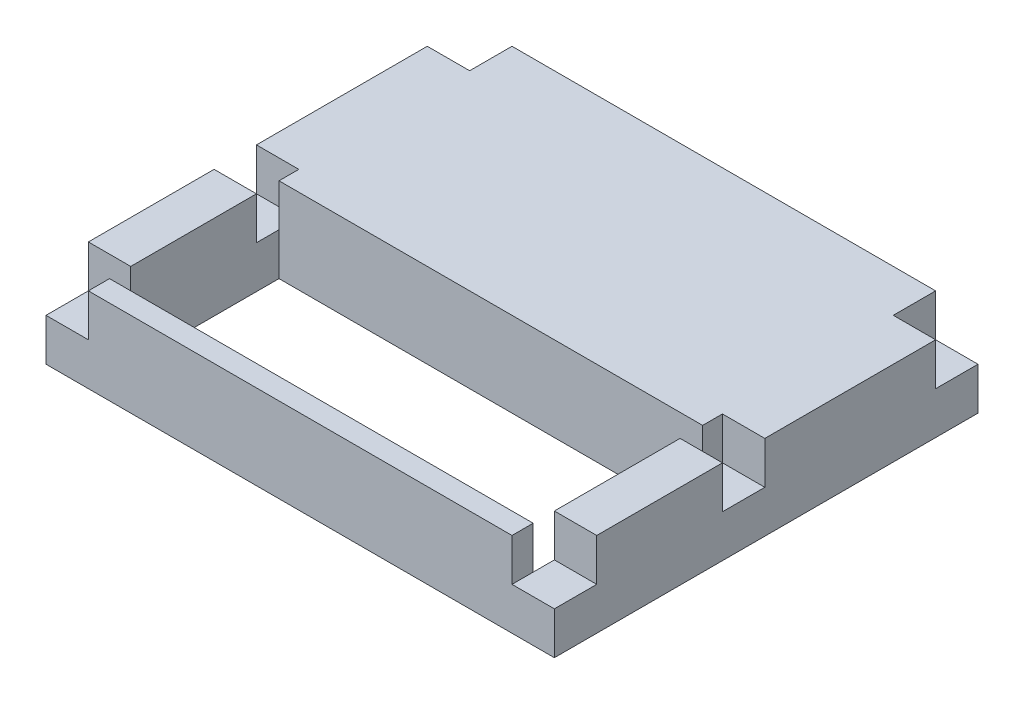
from build123d import *

# Parameters (mm, degrees)
SKETCH1_W           = 120
SKETCH1_H           = 100
BOSS_EXTRUDE1_DEPTH = 20
SKETCH6_W           = 110
SKETCH6_H           = 40
CUT_EXTRUDE1_DEPTH  = 20
SKETCH6_3_W         = 5
SKETCH6_3_H         = 40
BOSS_EXTRUDE4_DEPTH = 20
SKETCH14_W          = 10
SKETCH14_H          = 10
CUT_EXTRUDE2_DEPTH  = 10
SKETCH15_W          = 10
SKETCH15_H          = 10
CUT_EXTRUDE3_DEPTH  = 10


with BuildPart() as part:
    # Sketch1 → Boss-Extrude1 (new body)
    with BuildSketch(Plane(origin=(0, 0, 0), x_dir=(1, 0, 0), z_dir=(0, 1, 0))):
        Rectangle(SKETCH1_W, SKETCH1_H)
    extrude(amount=BOSS_EXTRUDE1_DEPTH)

    # Sketch6 → Cut-Extrude1 (cut)
    with BuildSketch(Plane.XZ):
        with Locations((0, 25)):
            Rectangle(SKETCH6_W, SKETCH6_H)
    extrude(amount=-CUT_EXTRUDE1_DEPTH, mode=Mode.SUBTRACT)

    # Sketch6<3> → Boss-Extrude4 (add)
    with BuildSketch(Plane.XZ):
        with Locations((-52.5, 25)):
            Rectangle(SKETCH6_3_W, SKETCH6_3_H)
        with Locations((52.5, 25)):
            Rectangle(SKETCH6_3_W, SKETCH6_3_H)
    extrude(amount=-BOSS_EXTRUDE4_DEPTH)

    # Sketch14 → Cut-Extrude2 (cut)
    with BuildSketch(Plane(origin=(0, 20, 0), x_dir=(1, 0, 0), z_dir=(0, 1, 0))):
        with Locations((55, -5.320888862)):
            Rectangle(SKETCH14_W, SKETCH14_H)
        with Locations((-55, -5.320888862)):
            Rectangle(SKETCH14_W, SKETCH14_H)
    extrude(amount=-CUT_EXTRUDE2_DEPTH, mode=Mode.SUBTRACT)

    # Sketch15 → Cut-Extrude3 (cut)
    with BuildSketch(Plane(origin=(0, 20, 0), x_dir=(1, 0, 0), z_dir=(0, 1, 0))):
        with Locations((-55, 45)):
            Rectangle(SKETCH15_W, SKETCH15_H)
        with Locations((55, 45)):
            Rectangle(SKETCH15_W, SKETCH15_H)
        with Locations((55, -45)):
            Rectangle(SKETCH15_W, SKETCH15_H)
        with Locations((-55, -45)):
            Rectangle(SKETCH15_W, SKETCH15_H)
    extrude(amount=-CUT_EXTRUDE3_DEPTH, mode=Mode.SUBTRACT)


solid = part.part
